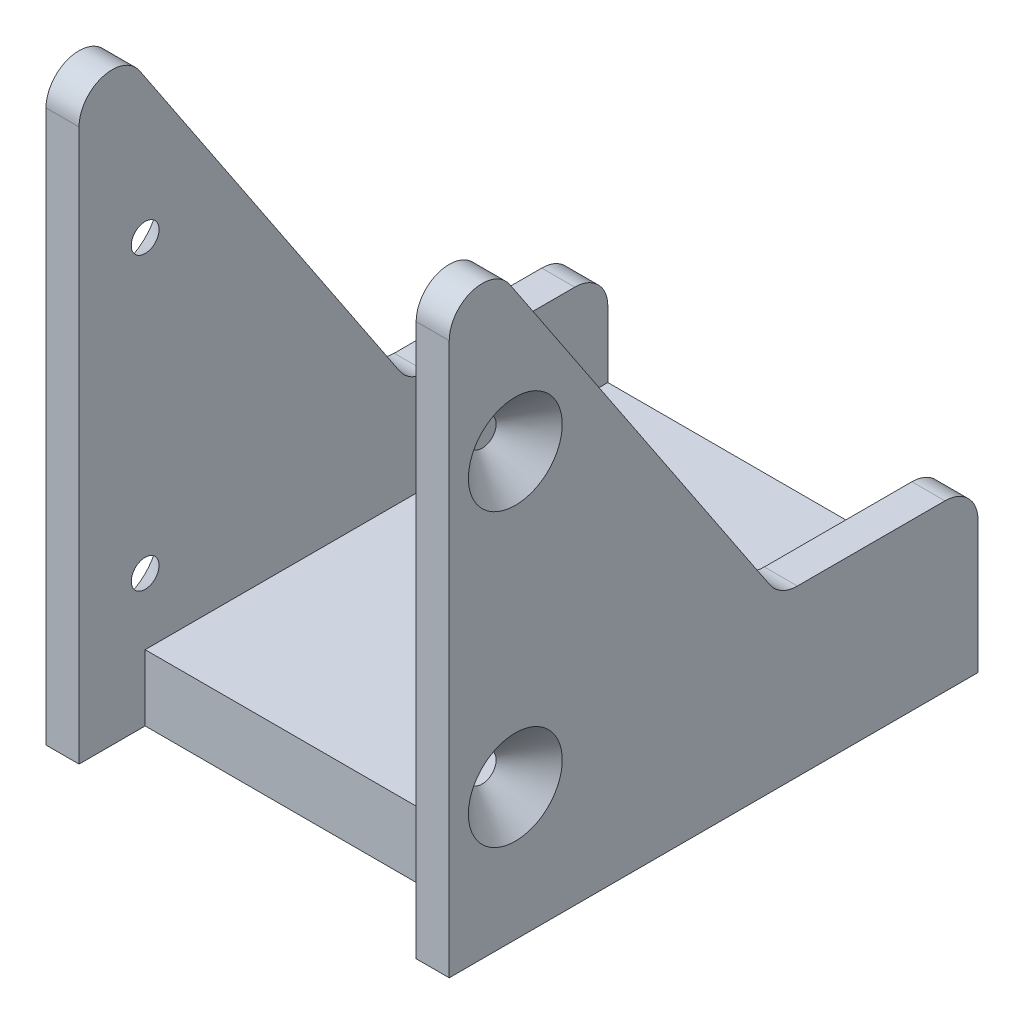
from build123d import *

# Parameters (mm, degrees)
SKETCH1_W           = 61
SKETCH1_H           = 100
BOSS_EXTRUDE1_DEPTH = 80
SKETCH2_OUTSIDE_W   = 110.37
SKETCH2_OUTSIDE_H   = 130.37
CUT_EXTRUDE1_DEPTH  = 113.343224095
SKETCH3_W           = 51
SKETCH3_H           = 90
CUT_EXTRUDE2_DEPTH  = 100.147617218
SKETCH4_W           = 51
SKETCH4_H           = 10
CUT_EXTRUDE3_DEPTH  = 125.21855739
FILLET3_R           = 5
FILLET4_R           = 5
SKETCH5_R           = 3.5
CUT_EXTRUDE4_DEPTH  = 117.147842498


with BuildPart() as part:
    # Sketch1 → Boss-Extrude1 (new body)
    with BuildSketch(Plane.XY):
        Rectangle(SKETCH1_W, SKETCH1_H)
    extrude(amount=-BOSS_EXTRUDE1_DEPTH)

    # Sketch2 outside → Cut-Extrude1 (cut, through all)
    with BuildSketch(Plane.ZY.offset(30.5)):
        with Locations((-40, 0)):
            Rectangle(SKETCH2_OUTSIDE_W, SKETCH2_OUTSIDE_H)
        Polygon((-80, -25), (-50, -25), (0, 50), (0, -50), (-80, -50), align=None, mode=Mode.SUBTRACT)
    extrude(amount=-CUT_EXTRUDE1_DEPTH, mode=Mode.SUBTRACT)

    # Sketch3 → Cut-Extrude2 (cut, through all)
    with BuildSketch(Plane.XY):
        with Locations((0, 5)):
            Rectangle(SKETCH3_W, SKETCH3_H)
    extrude(amount=-CUT_EXTRUDE2_DEPTH, mode=Mode.SUBTRACT)

    # Sketch4 → Cut-Extrude3 (cut, through all)
    with BuildSketch(Plane(origin=(0, -40, 0), x_dir=(1, 0, 0), z_dir=(0, 1, 0))):
        with Locations((0, 5)):
            Rectangle(SKETCH4_W, SKETCH4_H)
    extrude(amount=-CUT_EXTRUDE3_DEPTH, mode=Mode.SUBTRACT)

    # Sketch9<8> → Cut-Revolve4 (revolve, cut)
    with BuildSketch(Plane.XY.offset(-10)):
        Polygon((-23.4, 14), (-30.5, 6.9), (-30.5, 14), align=None)
    cut_revolve4 = revolve(axis=Axis((-30.5, 14, -10), (1, 0, 0)), mode=Mode.SUBTRACT)

    # Sketch9<9> → Cut-Revolve5 (revolve, cut)
    with BuildSketch(Plane.XY.offset(-10)):
        Polygon((-23.4, -30), (-30.5, -37.1), (-30.5, -30), align=None)
    cut_revolve5 = revolve(axis=Axis((-30.5, -30, -10), (1, 0, 0)), mode=Mode.SUBTRACT)

    # Mirror1: Cut-Revolve4, Cut-Revolve5 across plane
    add(cut_revolve4.mirror(Plane(origin=(0, 0, 0), x_dir=(0, 0, 1), z_dir=(1, 0, 0))), mode=Mode.SUBTRACT)
    add(cut_revolve5.mirror(Plane(origin=(0, 0, 0), x_dir=(0, 0, 1), z_dir=(1, 0, 0))), mode=Mode.SUBTRACT)

    # Fillet3
    fillet3_edges = [part.edges().sort_by_distance(p)[0] for p in [
        (28, 50, 0),
        (-28, 50, 0),
    ]]
    fillet(fillet3_edges, radius=FILLET3_R)

    # Fillet4
    fillet4_edges = [part.edges().sort_by_distance(p)[0] for p in [
        (28, -25, -80),
        (-28, -25, -80),
        (-28, -25, -50),
        (28, -25, -50),
    ]]
    fillet(fillet4_edges, radius=FILLET4_R)

    # Sketch5 → Cut-Extrude4 (cut, through all)
    with BuildSketch(Plane(origin=(0, -40, 0), x_dir=(1, 0, 0), z_dir=(0, 1, 0))):
        with Locations((0, 55)):
            Circle(SKETCH5_R)
    extrude(amount=-CUT_EXTRUDE4_DEPTH, mode=Mode.SUBTRACT)


solid = part.part
